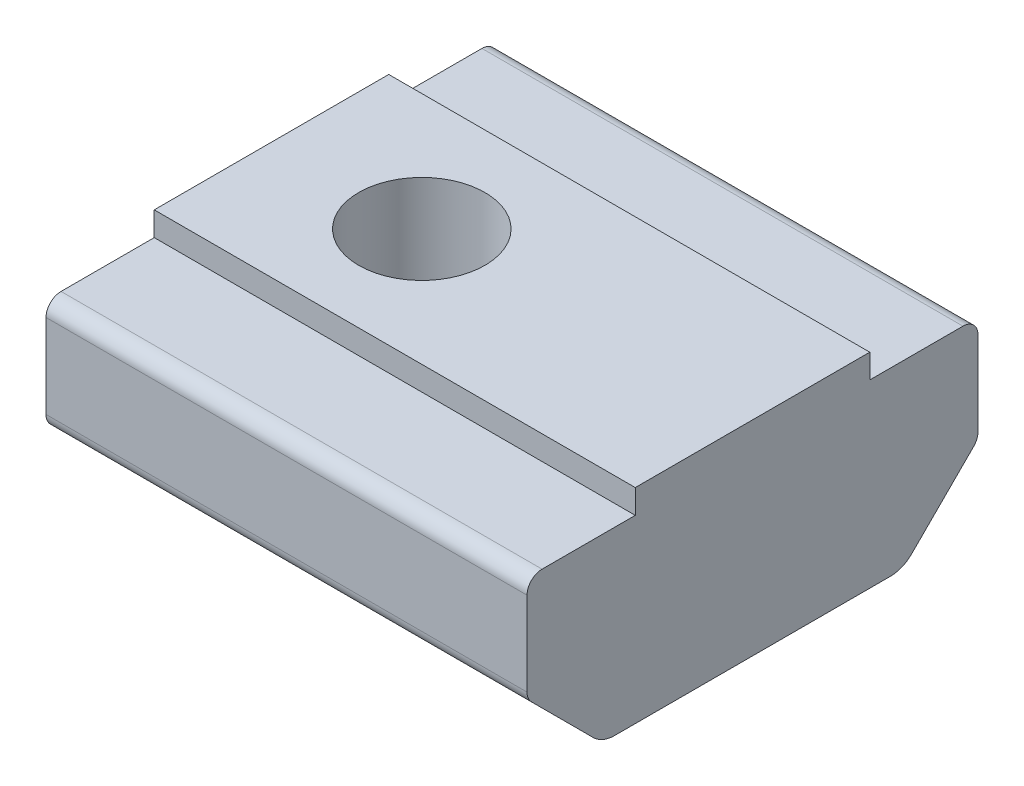
from build123d import *

# Parameters (mm, degrees)
BOSS_EXTRUDE1_DEPTH = 16
FILLET1_R           = 1
FILLET2_R           = 0.5
SKETCH2_W           = 2.35
SKETCH2_H           = 0.2
TAPPED_HOLE1_D      = 4.2


with BuildPart() as part:
    # Sketch1 → Boss-Extrude1 (new body)
    with BuildSketch(Plane(origin=(-5, 0, 0), x_dir=(0, 0, -1), z_dir=(1, 0, 0))):
        Polygon((3.9, 0), (-3.9, 0), (-3.9, -0.8), (-7.5, -0.8), (-7.5, -4.3), (-5, -6.8), (5, -6.8), (7.5, -4.3), (7.5, -0.8), (3.9, -0.8), align=None)
    extrude(amount=BOSS_EXTRUDE1_DEPTH)

    # Fillet1
    fillet1_edges = [part.edges().sort_by_distance(p)[0] for p in [
        (3, -6.8, -5),
        (3, -6.8, 5),
    ]]
    fillet(fillet1_edges, radius=FILLET1_R)

    # Fillet2
    fillet2_edges = [part.edges().sort_by_distance(p)[0] for p in [
        (3, -0.8, 7.5),
        (3, -0.8, -7.5),
        (3, -4.3, -7.5),
        (3, -4.3, 7.5),
    ]]
    fillet(fillet2_edges, radius=FILLET2_R)

    # Sketch2 → Cut-Revolve1 (revolve, cut)
    with BuildSketch(Plane(origin=(7, 0, 0), x_dir=(0, 0, -1), z_dir=(1, 0, 0)), mode=Mode.PRIVATE) as cut_revolve1_sk:
        with Locations((1.175, -6.7)):
            Rectangle(SKETCH2_W, SKETCH2_H)
    revolve(cut_revolve1_sk.sketch.rotate(Axis((7, 1.665548573, 0), (0, -1, 0)), 180), axis=Axis((7, 1.665548573, 0), (0, -1, 0)), mode=Mode.SUBTRACT)

    # Sketch3 → Revolve1 (revolve)
    with BuildSketch(Plane(origin=(7, 0, 0), x_dir=(0, 0, -1), z_dir=(1, 0, 0)), mode=Mode.PRIVATE) as revolve1_sk:
        with BuildLine():
            Line((1.989974874, -6.6), (0, -6.6))
            Line((0, -6.6), (0, -7.8))
            ThreePointArc((0, -7.8), (1.161895004, -7.476784887), (1.989974874, -6.6))
        make_face()
    revolve(revolve1_sk.sketch.rotate(Axis((7, 0, 0), (0, -1, 0)), 180), axis=Axis((7, 0, 0), (0, -1, 0)))

    # Tapped Hole1 (through all)
    with Locations(Plane(origin=(0, 0, 0), x_dir=(1, 0, 0), z_dir=(0, 1, 0))):
        with Locations((0, 0)):
            Hole(TAPPED_HOLE1_D / 2)


solid = part.part
